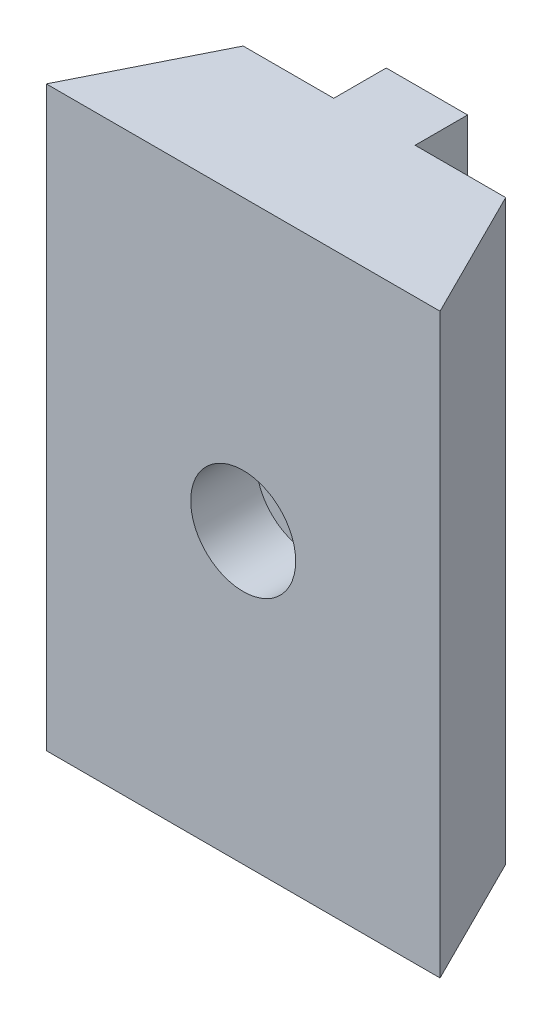
from build123d import *

# Parameters (mm, degrees)
EXTRUDE_1_DEPTH     = 14
CUT_EXTRUDE_1_DEPTH = 44
SKETCH_3_W          = 6.2
SKETCH_3_H          = 6.2
CUT_EXTRUDE_2_DEPTH = 4
SKETCH_4_R          = 4
CUT_EXTRUDE_3_DEPTH = 5
SKETCH_5_R          = 2.6
CUT_EXTRUDE_4_DEPTH = 5


with BuildPart() as part:
    # 草图1 → 凸台-拉伸1 (new body)
    with BuildSketch(Plane.XY):
        Polygon((-15, 22), (-15, -22), (15, -22), (15, 22), (0, 22), align=None)
    extrude(amount=EXTRUDE_1_DEPTH)

    # 草图2 → 切除-拉伸1 (cut)
    with BuildSketch(Plane(origin=(0, 22, 0), x_dir=(1, 0, 0), z_dir=(0, 1, 0))):
        Polygon((-15, 0), (-15, -14), (-10, -4), (-3.1, -4), (-3.1, 0), align=None)
        Polygon((3.1, -4), (10, -4), (15, -14), (15, 0), (3.1, 0), align=None)
    extrude(amount=-CUT_EXTRUDE_1_DEPTH, mode=Mode.SUBTRACT)

    # 草图3 → 切除-拉伸2 (cut)
    with BuildSketch(Plane(origin=(0, 0, 0), x_dir=(-1, 0, 0), z_dir=(0, 0, -1))):
        Rectangle(SKETCH_3_W, SKETCH_3_H)
    extrude(amount=-CUT_EXTRUDE_2_DEPTH, mode=Mode.SUBTRACT)

    # 草图4 → 切除-拉伸3 (cut)
    with BuildSketch(Plane.XY.offset(14)):
        Circle(SKETCH_4_R)
    extrude(amount=-CUT_EXTRUDE_3_DEPTH, mode=Mode.SUBTRACT)

    # 草图5 → 切除-拉伸4 (cut)
    with BuildSketch(Plane.XY.offset(9)):
        Circle(SKETCH_5_R)
    extrude(amount=-CUT_EXTRUDE_4_DEPTH, mode=Mode.SUBTRACT)


solid = part.part
